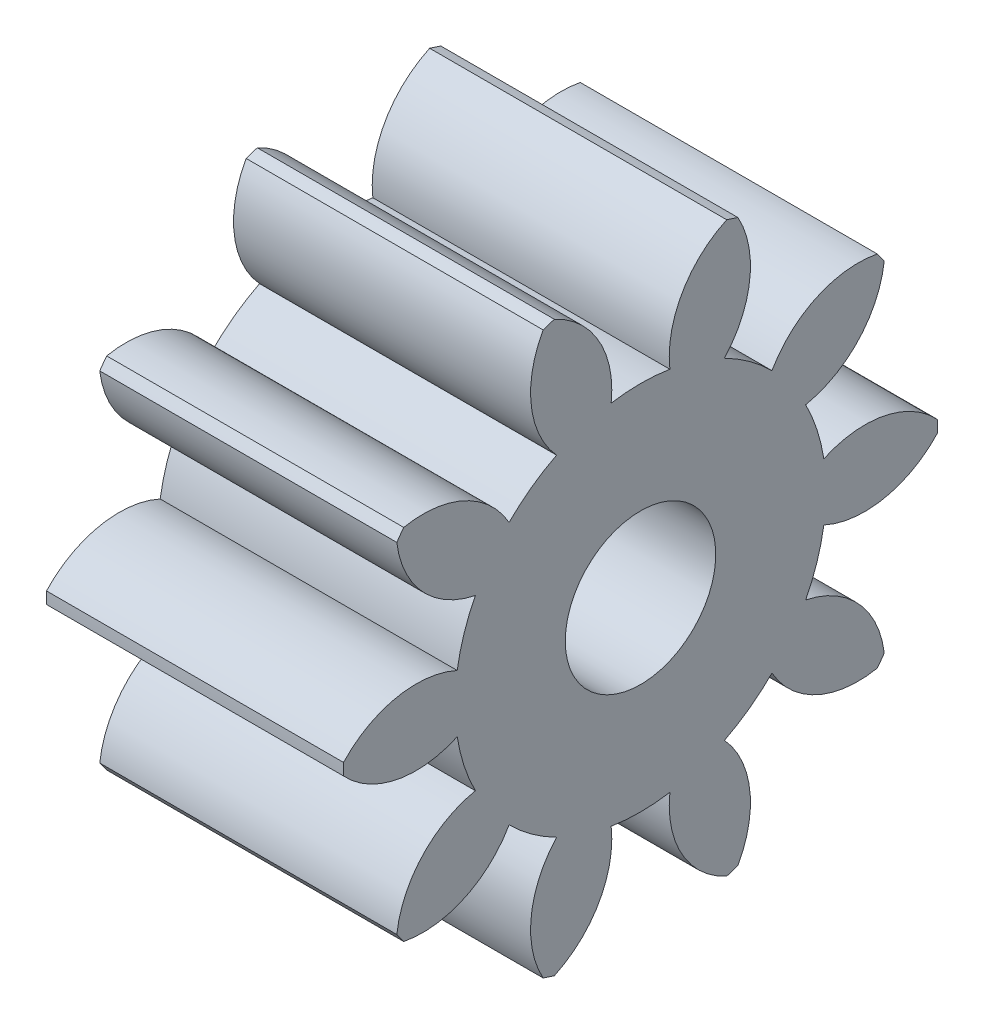
from build123d import *

# Parameters (mm, degrees)
BASPROSKE_W     = 3
BASPROSKE_H     = 3
TOOTHCUT_DEPTH  = 6.196152423
TEETHCUTS_COUNT = 10
TEETHCUTS_ANGLE = 324
BORSKE_R        = 0.76
BORE_DEPTH      = 50.0001016


with BuildPart() as part:
    # BasProSke → Base-Revolve (revolve)
    with BuildSketch(Plane(origin=(0, 0, 0), x_dir=(1, 0, 0), z_dir=(0, 1, 0)), mode=Mode.PRIVATE) as base_revolve_sk:
        with Locations((1.5, 1.5)):
            Rectangle(BASPROSKE_W, BASPROSKE_H)
    revolve(base_revolve_sk.sketch.rotate(Axis((-10, 0, 0), (1, 0, 0)), 180), axis=Axis((-10, 0, 0), (1, 0, 0)))

    # TooCutSke → ToothCut (cut, through all)
    with BuildSketch(Plane(origin=(0, 0, 0), x_dir=(0, 0, -1), z_dir=(1, 0, 0))):
        with BuildLine():
            ThreePointArc((0.296449938, 1.850403587), (0, 1.874), (-0.296449938, 1.850403587))
            ThreePointArc((-0.296449938, 1.850403587), (-0.428089565, 2.470295585), (-0.905889751, 2.886591228))
            ThreePointArc((-0.905889751, 2.886591228), (0, 3.0254), (0.905889751, 2.886591228))
            ThreePointArc((0.905889751, 2.886591228), (0.428089565, 2.470295585), (0.296449938, 1.850403587))
        make_face()
    toothcut = extrude(amount=TOOTHCUT_DEPTH, mode=Mode.SUBTRACT)

    # TeethCuts: ToothCut ×10 about axis
    teethcuts_axis = Axis((-10, 0, 0), (1, 0, 0))
    for i in range(1, TEETHCUTS_COUNT):
        add(toothcut.rotate(teethcuts_axis, i * TEETHCUTS_ANGLE / (TEETHCUTS_COUNT - 1)), mode=Mode.SUBTRACT)

    # BorSke → Bore (cut, symmetric)
    with BuildSketch(Plane(origin=(0, 0, 0), x_dir=(0, 0, -1), z_dir=(1, 0, 0))):
        with Locations(Location((0, 0, 0), (0, 0, 180))):
            Circle(BORSKE_R)
    extrude(amount=BORE_DEPTH, both=True, mode=Mode.SUBTRACT)


solid = part.part
